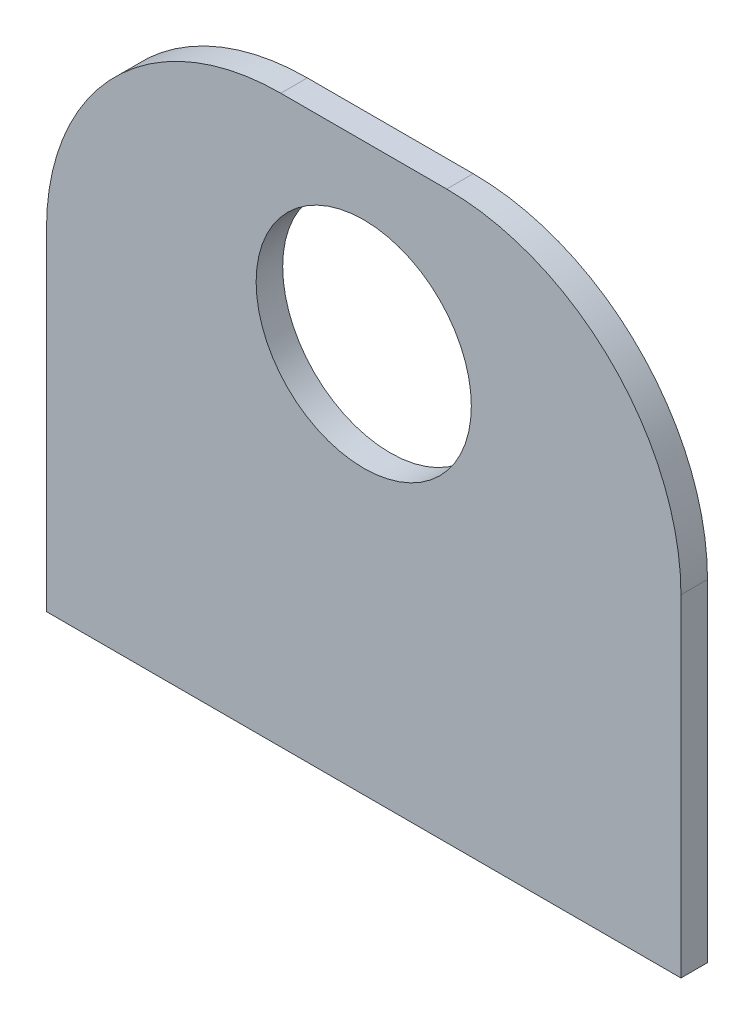
from build123d import *

# Parameters (mm, degrees)
SKETCH1_W           = 41.275
SKETCH1_H           = 36.83
SKETCH1_R           = 7
BOSS_EXTRUDE1_DEPTH = 1.7272
FILLET7_R           = 15.24


with BuildPart() as part:
    # Sketch1 → Boss-Extrude1 (new body)
    with BuildSketch(Plane.XY):
        with Locations((0, 18.415)):
            Rectangle(SKETCH1_W, SKETCH1_H)
        with Locations((0, 25.4)):
            Circle(SKETCH1_R, mode=Mode.SUBTRACT)
    extrude(amount=BOSS_EXTRUDE1_DEPTH)

    # Fillet7
    fillet7_edges = [part.edges().sort_by_distance(p)[0] for p in [
        (-20.6375, 36.83, 0.8636),
        (20.6375, 36.83, 0.8636),
    ]]
    fillet(fillet7_edges, radius=FILLET7_R)


solid = part.part
